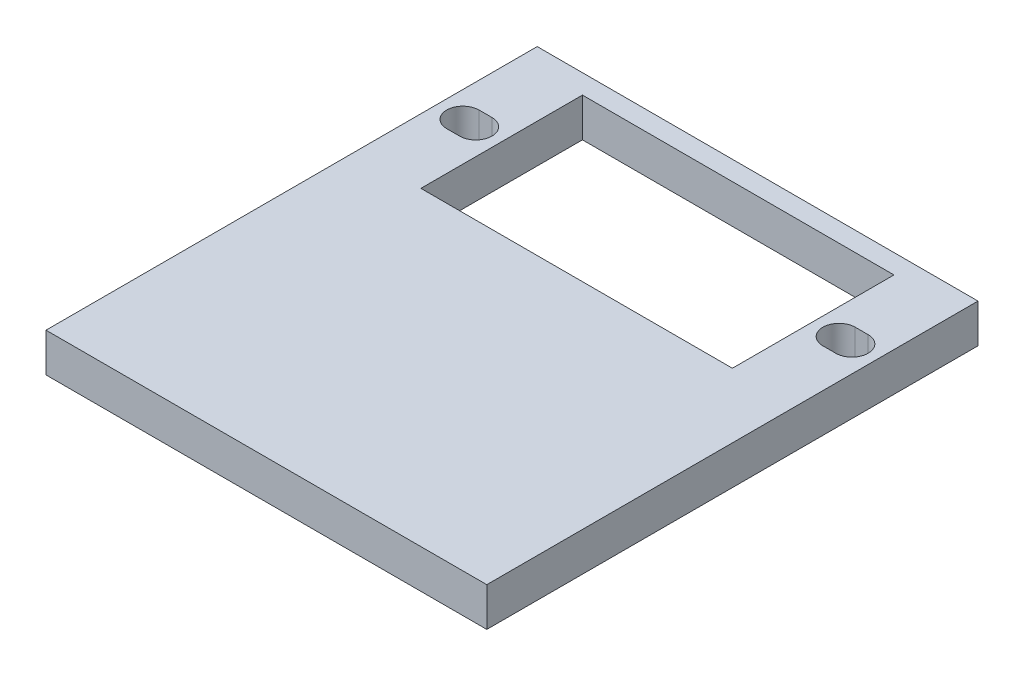
from build123d import *

# Parameters (mm, degrees)
BOSS_EXTRU_1_DEPTH = 3


with BuildPart() as part:
    # Esquisse1 → Boss.-Extru.1 (new body)
    with BuildSketch(Plane(origin=(0, 0, 0), x_dir=(1, 0, 0), z_dir=(0, 1, 0))):
        Polygon((-12.05, 36.5), (0, 36.5), (0, 38), (-17.05, 38), (-17.05, 0), (0, 0), (0, 24), (-12.05, 24), align=None)
        with BuildLine():
            ThreePointArc((-15.05, 29), (-16.3, 30.25), (-15.05, 31.5))
            Line((-15.05, 31.5), (-14.05, 31.5))
            ThreePointArc((-14.05, 31.5), (-12.8, 30.25), (-14.05, 29))
            Line((-14.05, 29), (-15.05, 29))
        make_face(mode=Mode.SUBTRACT)
    boss_extru_1 = extrude(amount=BOSS_EXTRU_1_DEPTH)

    # Symétrie1: Boss.-Extru.1 across plane
    add(boss_extru_1.mirror(Plane(origin=(0, 3, 0), x_dir=(0, 0, 1), z_dir=(-1, 0, 0))))


solid = part.part
